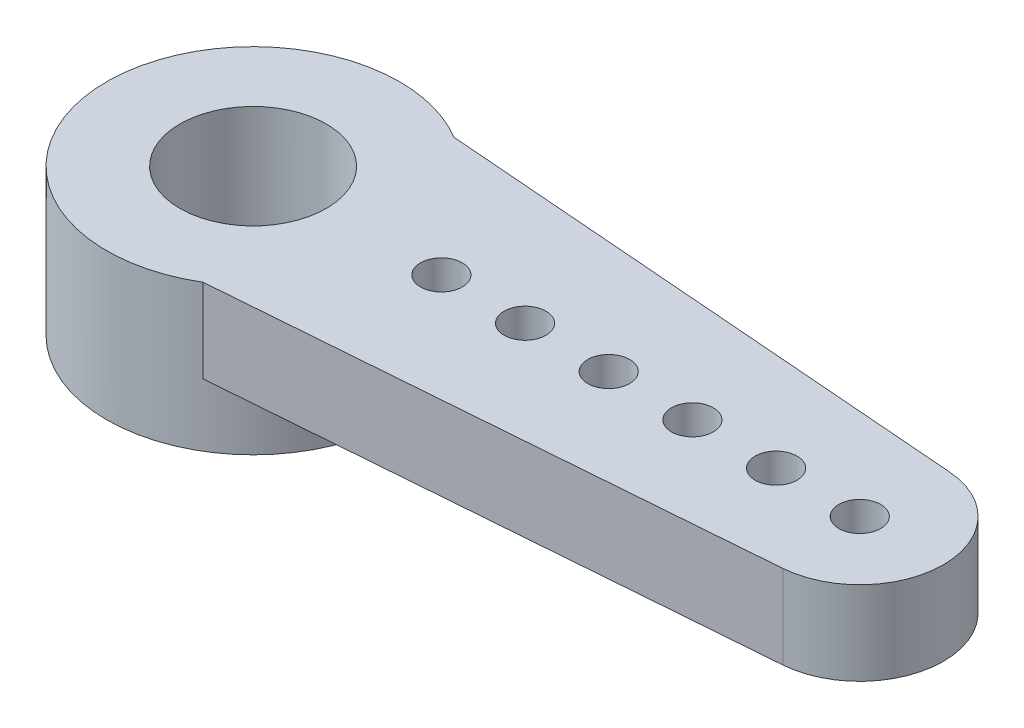
from build123d import *

# Parameters (mm, degrees)
BOSS_EXTRUDE1_DEPTH = 2
BOSS_EXTRUDE2_START = 1.5
SKETCH2_R           = 3.5
BOSS_EXTRUDE2_DEPTH = 1.5
SKETCH3_R           = 1.75
CUT_EXTRUDE1_DEPTH  = 5
SKETCH4_R           = 0.5
CUT_EXTRUDE2_DEPTH  = 5


with BuildPart() as part:
    # Sketch1 → Boss-Extrude1 (new body)
    with BuildSketch(Plane(origin=(0, 0, 0), x_dir=(1, 0, 0), z_dir=(0, 1, 0))):
        with BuildLine():
            Line((1.802775638, 3), (14.656073705, 1.99390095))
            ThreePointArc((14.656073705, 1.99390095), (16.5, 0), (14.656073705, -1.99390095))
            Line((14.656073705, -1.99390095), (1.802775638, -3))
            ThreePointArc((1.802775638, -3), (-3.5, 0), (1.802775638, 3))
        make_face()
    extrude(amount=BOSS_EXTRUDE1_DEPTH)

    # Sketch2 → Boss-Extrude2 (add)
    with BuildSketch(Plane.XZ.offset(BOSS_EXTRUDE2_START)):
        with Locations(Location((0, 0, 0), (0, 0, 270))):
            Circle(SKETCH2_R)
    extrude(amount=-BOSS_EXTRUDE2_DEPTH)

    # Sketch3 → Cut-Extrude1 (cut)
    with BuildSketch(Plane(origin=(0, 2, 0), x_dir=(1, 0, 0), z_dir=(0, 1, 0))):
        with Locations(Location((0, 0, 0), (0, 0, 270))):
            Circle(SKETCH3_R)
    extrude(amount=-CUT_EXTRUDE1_DEPTH, mode=Mode.SUBTRACT)

    # Sketch4 → Cut-Extrude2 (cut)
    with BuildSketch(Plane(origin=(0, 2, 0), x_dir=(1, 0, 0), z_dir=(0, 1, 0))):
        with Locations(Location((4.5, 0, 0), (0, 0, 270))):
            Circle(SKETCH4_R)
        with Locations(Location((6.5, 0, 0), (0, 0, 270))):
            Circle(SKETCH4_R)
        with Locations(Location((8.5, 0, 0), (0, 0, 270))):
            Circle(SKETCH4_R)
        with Locations(Location((10.5, 0, 0), (0, 0, 270))):
            Circle(SKETCH4_R)
        with Locations(Location((12.5, 0, 0), (0, 0, 270))):
            Circle(SKETCH4_R)
        with Locations(Location((14.5, 0, 0), (0, 0, 270))):
            Circle(SKETCH4_R)
    extrude(amount=-CUT_EXTRUDE2_DEPTH, mode=Mode.SUBTRACT)


solid = part.part
